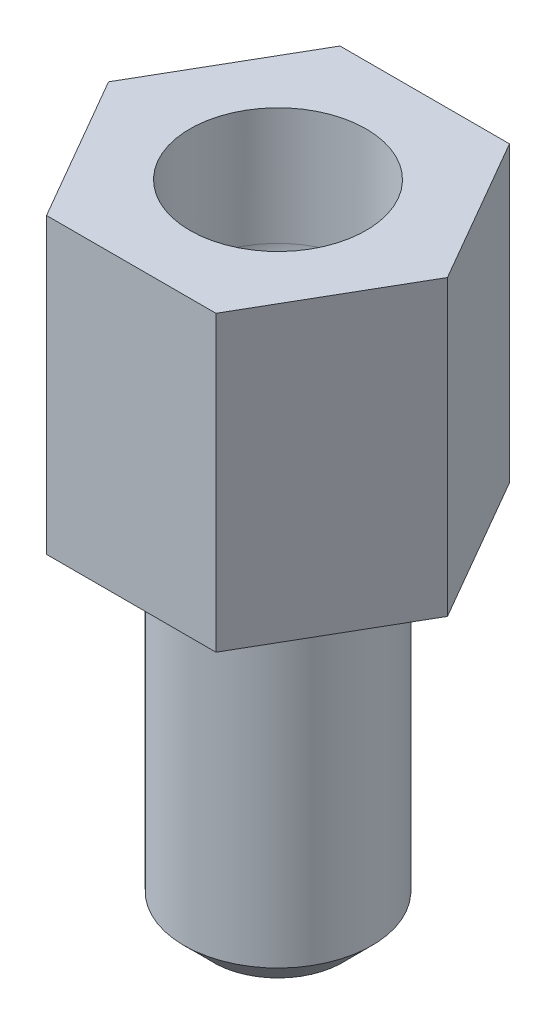
from build123d import *

# Parameters (mm, degrees)
SKETCH1_R           = 1.5
EXTRUDE1_DEPTH      = 5
EXTRUDE2_DEPTH      = 6
EXTRUDE2_DEPTH_BACK = 2
SKETCH2_R           = 1.6
CHAMFER1_SIZE       = 0.5
FILLET1_R           = 0.5
FILLET2_R           = 1


with BuildPart() as part:
    # Sketch1 → Extrude1 (new body)
    with BuildSketch(Plane(origin=(0, 0, 0), x_dir=(1, 0, 0), z_dir=(0, 1, 0))):
        Polygon((-1.443375673, 2.5), (1.443375673, 2.5), (2.886751346, 0), (1.443375673, -2.5), (-1.443375673, -2.5), (-2.886751346, 0), align=None)
        with Locations(Location((0, 0, 0), (0, 0, 270))):
            Circle(SKETCH1_R, mode=Mode.SUBTRACT)
    extrude(amount=EXTRUDE1_DEPTH)

    # Sketch2 → Extrude2 (add, two sides: drawn at the far end of the back side and taken through both)
    with BuildSketch(Plane.XZ.offset(-EXTRUDE2_DEPTH_BACK)):
        with Locations(Location((0, 0, 0), (0, 0, 270))):
            Circle(SKETCH2_R)
    extrude(amount=EXTRUDE2_DEPTH + EXTRUDE2_DEPTH_BACK)

    # Chamfer1
    chamfer1_edges = [part.edges().sort_by_distance(p)[0] for p in [
        (0, -6, 1.6),
    ]]
    chamfer(chamfer1_edges, length=CHAMFER1_SIZE)

    # Fillet1
    fillet1_edges = [part.edges().sort_by_distance(p)[0] for p in [
        (0, 0, 1.6),
    ]]
    fillet(fillet1_edges, radius=FILLET1_R)

    # Fillet2
    fillet2_edges = [part.edges().sort_by_distance(p)[0] for p in [
        (0, 2, -1.5),
    ]]
    fillet(fillet2_edges, radius=FILLET2_R)


solid = part.part
